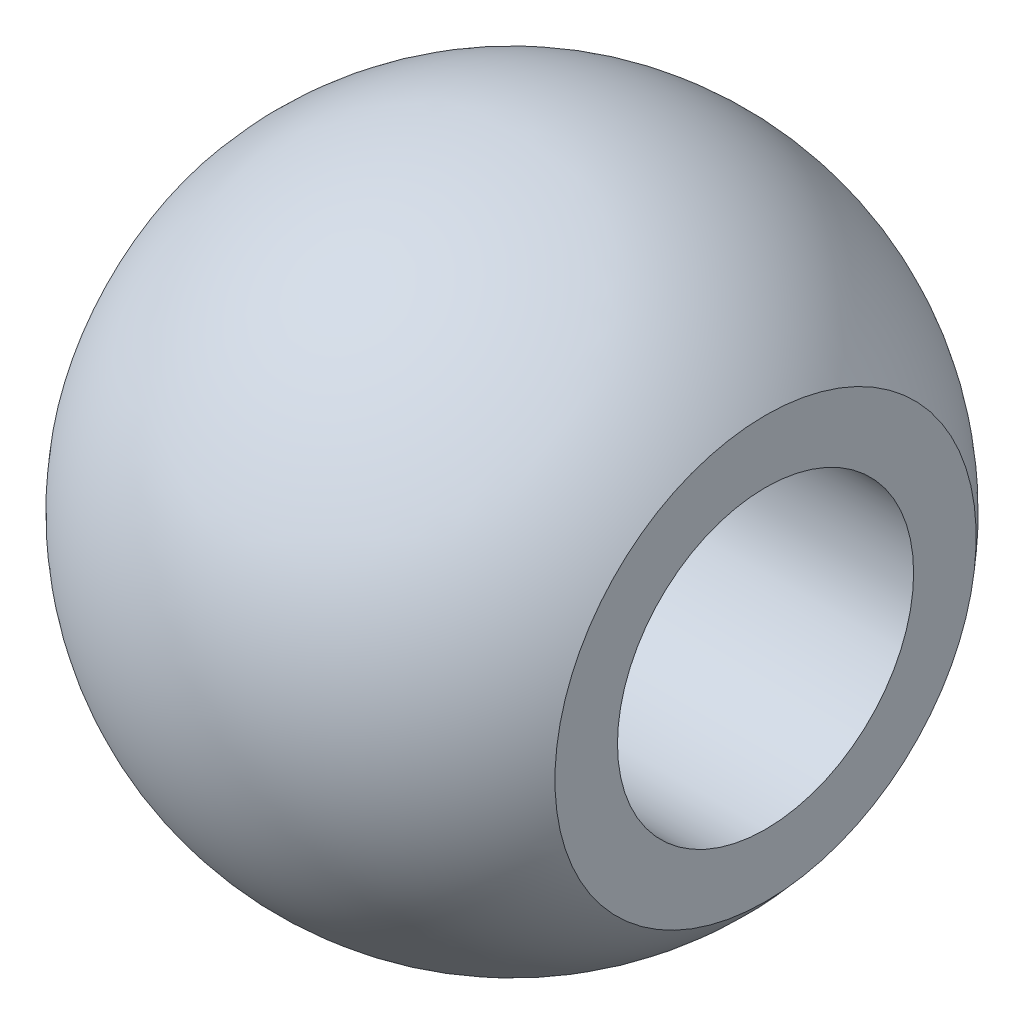
from build123d import *

# Parameters (mm, degrees)
TAGLIO_ESTRUSIONE1_DEPTH      = 6.629165125
TAGLIO_ESTRUSIONE1_DEPTH_BACK = 6.629165125
SCHIZZO2_R                    = 1.46
TAGLIO_ESTRUSIONE2_DEPTH      = 6.436533822
TAGLIO_ESTRUSIONE2_DEPTH_BACK = 6.436533822
SCHIZZO3_W                    = 0.403601212
SCHIZZO3_H                    = 6.501424145


with BuildPart() as part:
    # Schizzo1 → Rivoluzione1 (revolve)
    with BuildSketch(Plane.XY):
        with BuildLine():
            Line((0, 3.25), (0, -3.25))
            ThreePointArc((0, -3.25), (3.25, 0), (0, 3.25))
        make_face()
    revolve(axis=Axis((0, 3.25, 0), (0, -1, 0)))

    # Schizzo2 → Taglio-Estrusione1 (cut, two sides: drawn at the far end of the back side and taken through both)
    with BuildSketch(Plane(origin=(0, 0, 0), x_dir=(0, 0, -1), z_dir=(1, 0, 0)).offset(-TAGLIO_ESTRUSIONE1_DEPTH_BACK)):
        with Locations(Location((0, 0, 0), (0, 0, 180))):
            Circle(SCHIZZO2_R)
    extrude(amount=TAGLIO_ESTRUSIONE1_DEPTH + TAGLIO_ESTRUSIONE1_DEPTH_BACK, mode=Mode.SUBTRACT)

    # Schizzo3 → Taglio-Estrusione2 (cut, two sides: drawn at the far end of the back side and taken through both)
    with BuildSketch(Plane.XY.offset(-TAGLIO_ESTRUSIONE2_DEPTH_BACK)):
        with Locations((2.701800606, 0.000712073)):
            Rectangle(SCHIZZO3_W, SCHIZZO3_H)
        with Locations((-2.701800606, 0.000712073)):
            Rectangle(SCHIZZO3_W, SCHIZZO3_H)
    extrude(amount=TAGLIO_ESTRUSIONE2_DEPTH + TAGLIO_ESTRUSIONE2_DEPTH_BACK, mode=Mode.SUBTRACT)


solid = part.part
